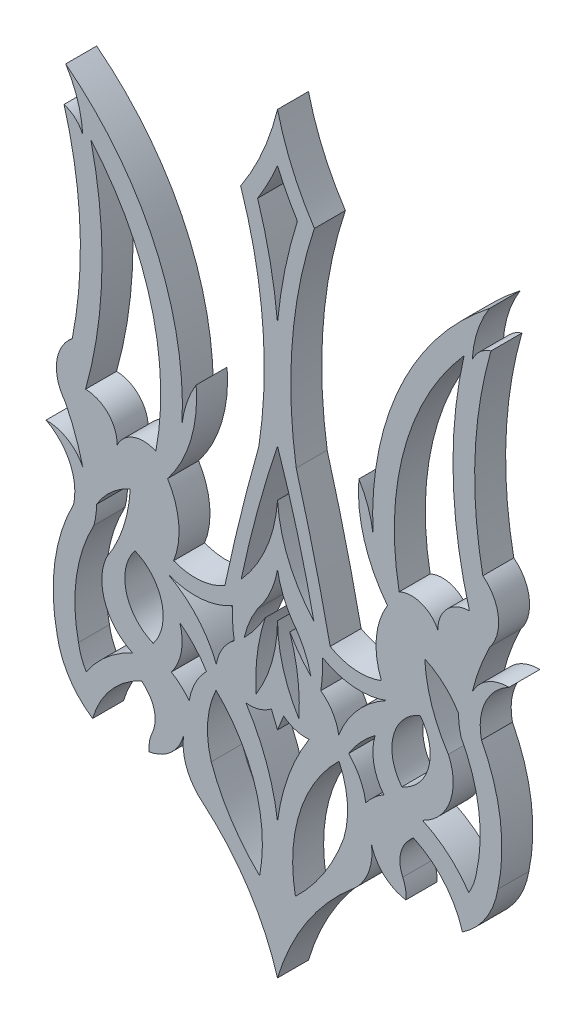
from build123d import *

# Parameters (mm, degrees)
EXTRUDE_1_DEPTH     = 10
CUT_EXTRUDE_4_DEPTH = 10


with BuildPart() as part:
    # Эскиз3 → Бобышка-Вытянуть1 (new body)
    with BuildSketch(Plane.XY):
        with BuildLine():
            ThreePointArc((75.737298173, 214.827117189), (82.873597213, 227.992034462), (87.644341315, 242.186463353))
            ThreePointArc((87.644341315, 242.186463353), (92.415085417, 227.992034462), (99.551384458, 214.827117189))
            ThreePointArc((99.551384458, 214.827117189), (92.448615199, 180.200274987), (93.683201055, 144.874033612))
            ThreePointArc((93.683201055, 144.874033612), (99.543941176, 122.77181273), (104.650975019, 100.483370703))
            ThreePointArc((104.650975019, 100.483370703), (112.761124808, 97.943619496), (121.169223706, 99.180041243))
            ThreePointArc((121.169223706, 99.180041243), (119.549894236, 110.406048742), (123.14170404, 121.164504703))
            ThreePointArc((123.14170404, 121.164504703), (115.644359384, 135.701433483), (113.915816321, 151.966261))
            ThreePointArc((113.915816321, 151.966261), (116.901405678, 145.64272451), (118.481996173, 138.830779763))
            ThreePointArc((118.481996173, 138.830779763), (127.24668609, 184.362661976), (156.055436754, 220.69485118))
            ThreePointArc((156.055436754, 220.69485118), (152.204137163, 212.503983736), (150.529344239, 203.609160148))
            ThreePointArc((150.529344239, 203.609160148), (152.949885488, 207.021489641), (156.580265974, 209.100756347))
            ThreePointArc((156.580265974, 209.100756347), (151.4198282, 177.15256964), (153.948768597, 144.889259016))
            ThreePointArc((153.948768597, 144.889259016), (158.962764238, 135.949313763), (156.186698644, 126.082387532))
            ThreePointArc((156.186698644, 126.082387532), (152.918092332, 118.533010155), (150.508133779, 110.667326092))
            ThreePointArc((150.508133779, 110.667326092), (155.402709379, 116.006658411), (162.390479703, 117.913594648))
            ThreePointArc((162.390479703, 117.913594648), (154.707516768, 109.824907217), (153.507722785, 98.733681937))
            ThreePointArc((153.507722785, 98.733681937), (159.570043449, 79.653195004), (158.80328853, 59.647475814))
            ThreePointArc((158.80328853, 59.647475814), (154.917566842, 49.613113406), (147.358546899, 41.95488388))
            ThreePointArc((147.358546899, 41.95488388), (141.45972495, 52.906488134), (131.532504975, 60.402089491))
            ThreePointArc((131.532504975, 60.402089491), (130.313453485, 59.224360677), (129.217982636, 57.930886552))
            ThreePointArc((129.217982636, 57.930886552), (127.222488275, 52.953447096), (128.085354098, 47.660776328))
            ThreePointArc((128.085354098, 47.660776328), (128.974997774, 44.792014096), (129.083146931, 41.790420124))
            ThreePointArc((129.083146931, 41.790420124), (122.02961795, 45.187826335), (117.983840441, 51.890536563))
            ThreePointArc((117.983840441, 51.890536563), (116.942345618, 43.244180813), (111.79351299, 36.220385415))
            ThreePointArc((111.79351299, 36.220385415), (97.034028223, 19.487966284), (87.644341315, -0.751846469))
            ThreePointArc((87.644341315, -0.751846469), (78.254654407, 19.487966284), (63.495169641, 36.220385415))
            ThreePointArc((63.495169641, 36.220385415), (58.346337012, 43.244180813), (57.30484219, 51.890536563))
            ThreePointArc((57.30484219, 51.890536563), (53.25906468, 45.187826335), (46.205535699, 41.790420124))
            ThreePointArc((46.205535699, 41.790420124), (46.313684857, 44.792014096), (47.203328533, 47.660776328))
            ThreePointArc((47.203328533, 47.660776328), (48.066194355, 52.953447096), (46.070699995, 57.930886552))
            ThreePointArc((46.070699995, 57.930886552), (44.975229145, 59.224360677), (43.756177656, 60.402089491))
            ThreePointArc((43.756177656, 60.402089491), (33.828957681, 52.906488134), (27.930135731, 41.95488388))
            ThreePointArc((27.930135731, 41.95488388), (20.371115788, 49.613113406), (16.4853941, 59.647475814))
            ThreePointArc((16.4853941, 59.647475814), (15.718639182, 79.653195004), (21.780959845, 98.733681937))
            ThreePointArc((21.780959845, 98.733681937), (20.581165862, 109.824907217), (12.898202928, 117.913594648))
            ThreePointArc((12.898202928, 117.913594648), (19.885973252, 116.006658411), (24.780548852, 110.667326092))
            ThreePointArc((24.780548852, 110.667326092), (22.370590299, 118.533010155), (19.101983986, 126.082387532))
            ThreePointArc((19.101983986, 126.082387532), (16.325918393, 135.949313763), (21.339914033, 144.889259016))
            ThreePointArc((21.339914033, 144.889259016), (23.868854431, 177.15256964), (18.708416657, 209.100756347))
            ThreePointArc((18.708416657, 209.100756347), (22.338797143, 207.021489641), (24.759338391, 203.609160148))
            ThreePointArc((24.759338391, 203.609160148), (23.084545467, 212.503983736), (19.233245877, 220.69485118))
            ThreePointArc((19.233245877, 220.69485118), (48.041996541, 184.362661976), (56.806686458, 138.830779763))
            ThreePointArc((56.806686458, 138.830779763), (58.387276952, 145.64272451), (61.37286631, 151.966261))
            ThreePointArc((61.37286631, 151.966261), (59.644323247, 135.701433483), (52.14697859, 121.164504703))
            ThreePointArc((52.14697859, 121.164504703), (55.738788395, 110.406048742), (54.119458925, 99.180041243))
            ThreePointArc((54.119458925, 99.180041243), (62.527557822, 97.943619496), (70.637707612, 100.483370703))
            ThreePointArc((70.637707612, 100.483370703), (75.744741455, 122.77181273), (81.605481576, 144.874033612))
            ThreePointArc((81.605481576, 144.874033612), (82.840067432, 180.200274987), (75.737298173, 214.827117189))
        make_face()
    extrude(amount=EXTRUDE_1_DEPTH)

    # Эскиз4 → Вырез-Вытянуть4 (cut)
    with BuildSketch(Plane.XY):
        with BuildLine():
            Line((85.654622356, 73.518555252), (87.644341315, 68.631836287))
            Line((87.644341315, 68.631836287), (89.634060275, 73.518555252))
            ThreePointArc((89.634060275, 73.518555252), (93.498316524, 71.48652915), (97.84617103, 71.089329421))
            ThreePointArc((97.84617103, 71.089329421), (91.177891627, 57.600515287), (87.644341315, 42.974234859))
            ThreePointArc((87.644341315, 42.974234859), (84.110791004, 57.600515287), (77.442511601, 71.089329421))
            ThreePointArc((77.442511601, 71.089329421), (81.790366107, 71.48652915), (85.654622356, 73.518555252))
        make_face()
        with BuildLine():
            ThreePointArc((87.644341315, 148.003447902), (81.149794041, 126.61690118), (75.910198282, 104.888805053))
            ThreePointArc((75.910198282, 104.888805053), (84.118417763, 117.892428675), (87.644341315, 132.860292833))
            ThreePointArc((87.644341315, 132.860292833), (91.170264867, 117.892428675), (99.378484349, 104.888805053))
            ThreePointArc((99.378484349, 104.888805053), (94.138888589, 126.61690118), (87.644341315, 148.003447902))
        make_face()
        with BuildLine():
            ThreePointArc((67.78082661, 69.825446008), (80.476833117, 49.16569034), (81.871403931, 24.956823002))
            ThreePointArc((81.871403931, 24.956823002), (72.654345055, 36.068206288), (66.24306766, 49.003140961))
            ThreePointArc((66.24306766, 49.003140961), (65.085086418, 59.556595084), (67.78082661, 69.825446008))
        make_face()
        with BuildLine():
            ThreePointArc((64.682165911, 73.518555252), (60.834261147, 78.585776038), (56.108384596, 82.845962464))
            ThreePointArc((56.108384596, 82.845962464), (56.577504562, 74.908677344), (53.334779442, 67.648835581))
            ThreePointArc((53.334779442, 67.648835581), (56.48094396, 65.35561463), (59.118823877, 62.492259422))
            ThreePointArc((59.118823877, 62.492259422), (61.041725308, 68.438701437), (64.682165911, 73.518555252))
        make_face()
        with BuildLine():
            ThreePointArc((67.908044121, 77.068549767), (61.672372831, 87.192623316), (52.307890576, 94.519760123))
            ThreePointArc((52.307890576, 94.519760123), (62.92084749, 92.959111172), (73.157724023, 96.164862015))
            ThreePointArc((73.157724023, 96.164862015), (73.141858231, 91.35681801), (73.672035417, 86.578068066))
            ThreePointArc((73.672035417, 86.578068066), (69.829998601, 82.405217354), (67.908044121, 77.068549767))
        make_face()
        with BuildLine():
            ThreePointArc((41.61812339, 95.708730185), (50.25104013, 85.706484776), (47.509430651, 72.781480245))
            ThreePointArc((47.509430651, 72.781480245), (38.786154146, 82.76050712), (41.61812339, 95.708730185))
        make_face()
        with BuildLine():
            ThreePointArc((87.644341315, 113.482689605), (85.301833907, 105.901746444), (81.11356181, 99.162576093))
            ThreePointArc((81.11356181, 99.162576093), (78.547855311, 94.272524198), (76.868511973, 89.011795795))
            ThreePointArc((76.868511973, 89.011795795), (80.536350092, 93.319090667), (83.674715416, 98.026158616))
            ThreePointArc((83.674715416, 98.026158616), (81.109027837, 86.746987848), (80.737859658, 75.18564363))
            ThreePointArc((80.737859658, 75.18564363), (85.835163519, 86.700542561), (87.644341315, 99.162576093))
            ThreePointArc((87.644341315, 99.162576093), (89.453519111, 86.700542561), (94.550822973, 75.18564363))
            ThreePointArc((94.550822973, 75.18564363), (94.179654794, 86.746987848), (91.613967215, 98.026158616))
            ThreePointArc((91.613967215, 98.026158616), (94.752332539, 93.319090667), (98.420170657, 89.011795795))
            ThreePointArc((98.420170657, 89.011795795), (96.74082732, 94.272524198), (94.17512082, 99.162576093))
            ThreePointArc((94.17512082, 99.162576093), (89.986848724, 105.901746444), (87.644341315, 113.482689605))
        make_face()
        with BuildLine():
            ThreePointArc((133.670559241, 95.708730185), (136.502528485, 82.76050712), (127.779251979, 72.781480245))
            ThreePointArc((127.779251979, 72.781480245), (125.0376425, 85.706484776), (133.670559241, 95.708730185))
        make_face()
        with BuildLine():
            ThreePointArc((101.616647213, 86.578068066), (102.1468244, 91.35681801), (102.130958608, 96.164862015))
            ThreePointArc((102.130958608, 96.164862015), (112.36783514, 92.959111172), (122.980792054, 94.519760123))
            ThreePointArc((122.980792054, 94.519760123), (113.6163098, 87.192623316), (107.38063851, 77.068549767))
            ThreePointArc((107.38063851, 77.068549767), (105.45868403, 82.405217354), (101.616647213, 86.578068066))
        make_face()
        with BuildLine():
            ThreePointArc((116.169858754, 62.492259422), (118.807738671, 65.35561463), (121.953903189, 67.648835581))
            ThreePointArc((121.953903189, 67.648835581), (118.711178069, 74.908677344), (119.180298034, 82.845962464))
            ThreePointArc((119.180298034, 82.845962464), (114.454421483, 78.585776038), (110.60651672, 73.518555252))
            ThreePointArc((110.60651672, 73.518555252), (114.246957322, 68.438701437), (116.169858754, 62.492259422))
        make_face()
        with BuildLine():
            ThreePointArc((109.045614971, 49.003140961), (110.203596213, 59.556595084), (107.507856021, 69.825446008))
            ThreePointArc((107.507856021, 69.825446008), (94.811849514, 49.16569034), (93.417278699, 24.956823002))
            ThreePointArc((93.417278699, 24.956823002), (102.634337575, 36.068206288), (109.045614971, 49.003140961))
        make_face()
        with BuildLine():
            ThreePointArc((40.827082091, 66.759793414), (31.96149709, 76.3488801), (32.473090037, 89.398303594))
            ThreePointArc((32.473090037, 89.398303594), (37.826341719, 100.334285592), (40.0944312, 112.29709362))
            ThreePointArc((40.0944312, 112.29709362), (33.897404233, 108.232129726), (29.194011854, 102.504549538))
            ThreePointArc((29.194011854, 102.504549538), (28.987352851, 99.334347847), (28.370873744, 96.217804856))
            ThreePointArc((28.370873744, 96.217804856), (22.699614148, 79.033148119), (23.365701976, 60.94912369))
            ThreePointArc((23.365701976, 60.94912369), (24.292977573, 57.352257012), (25.886565586, 53.996997383))
            ThreePointArc((25.886565586, 53.996997383), (32.473090037, 61.412921017), (40.827082091, 66.759793414))
        make_face()
        with BuildLine():
            ThreePointArc((48.355392718, 126.900367718), (46.714086351, 167.601052005), (27.386922462, 203.457715599))
            ThreePointArc((27.386922462, 203.457715599), (30.940238269, 168.082502681), (25.662297387, 132.923221086))
            ThreePointArc((25.662297387, 132.923221086), (32.940011964, 129.766489423), (35.853986928, 122.388221729))
            ThreePointArc((35.853986928, 122.388221729), (41.170193791, 127.233420637), (48.355392718, 126.900367718))
        make_face()
        with BuildLine():
            ThreePointArc((151.922980655, 60.94912369), (150.995705058, 57.352257012), (149.402117045, 53.996997383))
            ThreePointArc((149.402117045, 53.996997383), (142.815592594, 61.412921017), (134.461600539, 66.759793414))
            ThreePointArc((134.461600539, 66.759793414), (143.327185541, 76.3488801), (142.815592594, 89.398303594))
            ThreePointArc((142.815592594, 89.398303594), (137.462340912, 100.334285592), (135.194251431, 112.29709362))
            ThreePointArc((135.194251431, 112.29709362), (141.391278397, 108.232129726), (146.094670777, 102.504549538))
            ThreePointArc((146.094670777, 102.504549538), (146.30132978, 99.334347847), (146.917808886, 96.217804856))
            ThreePointArc((146.917808886, 96.217804856), (152.589068482, 79.033148119), (151.922980655, 60.94912369))
        make_face()
        with BuildLine():
            ThreePointArc((139.434695702, 122.388221729), (134.11848884, 127.233420637), (126.933289913, 126.900367718))
            ThreePointArc((126.933289913, 126.900367718), (128.57459628, 167.601052005), (147.901760168, 203.457715599))
            ThreePointArc((147.901760168, 203.457715599), (144.348444361, 168.082502681), (149.626385244, 132.923221086))
            ThreePointArc((149.626385244, 132.923221086), (142.348670666, 129.766489423), (139.434695702, 122.388221729))
        make_face()
        with BuildLine():
            ThreePointArc((94.066919651, 214.119894368), (90.031739471, 198.523177696), (87.644341315, 182.590802479))
            ThreePointArc((87.644341315, 182.590802479), (85.25694316, 198.523177696), (81.22176298, 214.119894368))
            ThreePointArc((81.22176298, 214.119894368), (84.665732339, 220.152220055), (87.644341315, 226.427390706))
            ThreePointArc((87.644341315, 226.427390706), (90.622950292, 220.152220055), (94.066919651, 214.119894368))
        make_face()
    extrude(amount=CUT_EXTRUDE_4_DEPTH, mode=Mode.SUBTRACT)


solid = part.part
